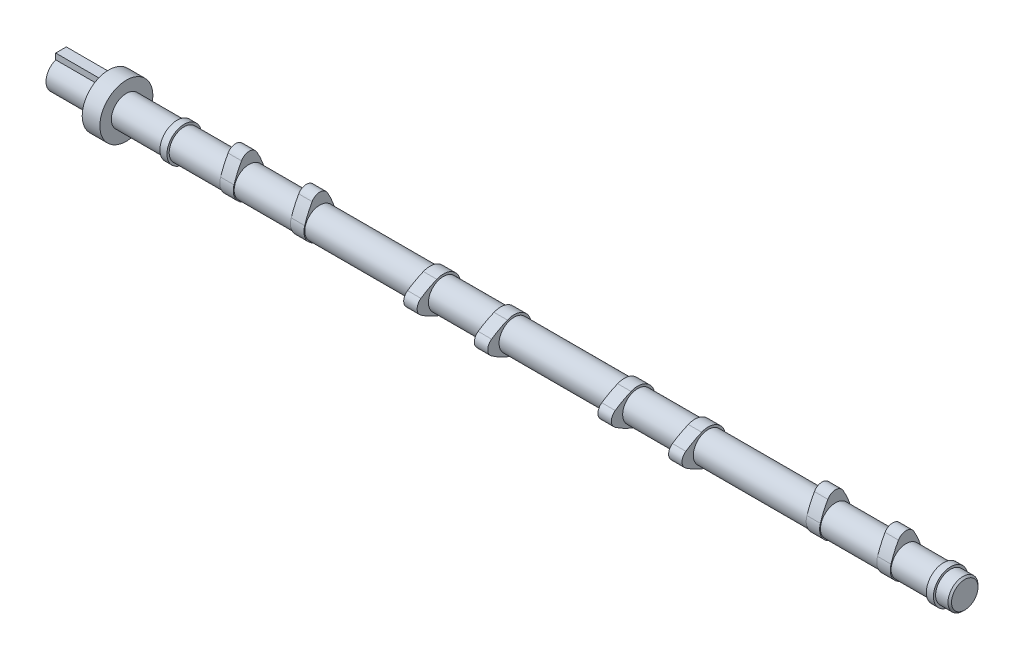
from build123d import *

# Parameters (mm, degrees)
CROQUIS1_W                       = 580
CROQUIS1_H                       = 8.5
CROQUIS4_R                       = 9.75
SALIENTE_EXTRUIR1_DEPTH          = 4
MATRIZL1_COUNT                   = 2
MATRIZL1_PITCH                   = 442
SALIENTE_EXTRUIR3_DEPTH          = 3.8
MATRIZL2_COUNT                   = 2
MATRIZL2_PITCH                   = 40
MATRIZL3_COUNT                   = 2
MATRIZL3_PITCH                   = 332
MATRIZL3_COPY_1_DEPTH            = 3.8
CROQUIS6_R                       = 8.5
SALIENTE_EXTRUIR4_DEPTH          = 3.8
MATRIZL4_COUNT                   = 2
MATRIZL4_PITCH                   = 40
MATRIZL5_COUNT                   = 2
MATRIZL5_PITCH                   = 110
MATRIZL5_COPY_1_SKETCH_R         = 8.5
MATRIZL5_COPY_1_DEPTH            = 3.8
CROQUIS7_R                       = 9.75
CORTAR_EXTRUIR1_DEPTH            = 12
SALIENTE_EXTRUIR5_START          = 4
CROQUIS8_R                       = 9.75
SALIENTE_EXTRUIR5_DEPTH          = 4
SALIENTE_EXTRUIR6_START          = 8
CROQUIS9_R                       = 8.5
SALIENTE_EXTRUIR6_DEPTH          = 8
CHAFL_N1_SIZE                    = 1
SALIENTE_EXTRUIR7_DEPTH          = 5
SALIENTE_EXTRUIR7_DEPTH_BACK     = 5
CROQUIS10_R                      = 15
CROQUIS11_W                      = 6
CROQUIS11_H                      = 3.35
SALIENTE_EXTRUIR8_DEPTH          = 40
CORTAR_EXTRUIR2_START            = -68.25
CROQUIS12_R                      = 47.247145798
CORTAR_EXTRUIR2_DEPTH            = 68.25
TALADRO_DE_MARGEN_PARA_M71_D     = 7.6
TALADRO_DE_MARGEN_PARA_M71_DEPTH = 30
TALADRO_DE_MARGEN_PARA_M71_TIP   = 2.283270352


with BuildPart() as part:
    # Croquis1 → Revolución1 (revolve)
    with BuildSketch(Plane.XY, mode=Mode.PRIVATE) as revoluci_n1_sk:
        with Locations((290, 4.25)):
            Rectangle(CROQUIS1_W, CROQUIS1_H)
    revolve(revoluci_n1_sk.sketch.rotate(Axis((0, 8.5, 0), (1, 0, 0)), 270), axis=Axis((0, 8.5, 0), (1, 0, 0)))

    # Croquis4 → Saliente-Extruir1 (add)
    with BuildSketch(Plane(origin=(580, 0, 0), x_dir=(0, 0, -1), z_dir=(1, 0, 0))):
        with Locations((0, 8.5)):
            Circle(CROQUIS4_R)
    saliente_extruir1 = extrude(amount=-SALIENTE_EXTRUIR1_DEPTH)

    # MatrizL1: Saliente-Extruir1 ×2
    with Locations(*[(-i * MATRIZL1_PITCH, 0, 0) for i in range(1, MATRIZL1_COUNT)]):
        add(saliente_extruir1)

    # Croquis5 → Saliente-Extruir3 (add, symmetric)
    with BuildSketch(Plane(origin=(171, 0, 0), x_dir=(0, 0, -1), z_dir=(1, 0, 0))):
        with BuildLine():
            ThreePointArc((-8.57686354, 11.227161863), (0, -0.5), (8.57686354, 11.227161863))
            ThreePointArc((8.57686354, 11.227161863), (6.71423124, 16.165722115), (4.341375372, 20.880415264))
            ThreePointArc((4.341375372, 20.880415264), (0, 23.4), (-4.341375372, 20.880415264))
            ThreePointArc((-4.341375372, 20.880415264), (-6.71423124, 16.165722115), (-8.57686354, 11.227161863))
        make_face()
    saliente_extruir3 = extrude(amount=SALIENTE_EXTRUIR3_DEPTH, both=True)

    # MatrizL2: Saliente-Extruir3 ×2
    with Locations(*[(i * MATRIZL2_PITCH, 0, 0) for i in range(1, MATRIZL2_COUNT)]):
        add(saliente_extruir3)

    # MatrizL3: Saliente-Extruir3 ×2
    with Locations(*[(i * MATRIZL3_PITCH, 0, 0) for i in range(1, MATRIZL3_COUNT)]):
        add(saliente_extruir3)

    # MatrizL3 copy 1 sketch → MatrizL3 copy 1 (add, symmetric)
    with BuildSketch(Plane(origin=(543, 0, 0), x_dir=(0, 0, -1), z_dir=(1, 0, 0))):
        with BuildLine():
            ThreePointArc((-8.57686354, 11.227161863), (0, -0.5), (8.57686354, 11.227161863))
            ThreePointArc((8.57686354, 11.227161863), (6.71423124, 16.165722115), (4.341375372, 20.880415264))
            ThreePointArc((4.341375372, 20.880415264), (0, 23.4), (-4.341375372, 20.880415264))
            ThreePointArc((-4.341375372, 20.880415264), (-6.71423124, 16.165722115), (-8.57686354, 11.227161863))
        make_face()
    extrude(amount=MATRIZL3_COPY_1_DEPTH, both=True)

    # Croquis6 → Saliente-Extruir4 (add, symmetric)
    with BuildSketch(Plane(origin=(281, 0, 0), x_dir=(0, 0, -1), z_dir=(1, 0, 0))):
        with BuildLine():
            ThreePointArc((-12.722376543, 12.627249768), (-14.9, 8.5), (-12.722376543, 4.372750232))
            ThreePointArc((-12.722376543, 4.372750232), (-8.363270987, 1.70804262), (-3.754994824, -0.497917196))
            ThreePointArc((-3.754994824, -0.497917196), (9.75, 8.5), (-3.754994824, 17.497917196))
            ThreePointArc((-3.754994824, 17.497917196), (-8.363270987, 15.29195738), (-12.722376543, 12.627249768))
        make_face()
        with Locations(Location((0, 8.5, 0), (0, 0, 180))):
            Circle(CROQUIS6_R, mode=Mode.SUBTRACT)
    saliente_extruir4 = extrude(amount=SALIENTE_EXTRUIR4_DEPTH, both=True)

    # MatrizL4: Saliente-Extruir4 ×2
    with Locations(*[(i * MATRIZL4_PITCH, 0, 0) for i in range(1, MATRIZL4_COUNT)]):
        add(saliente_extruir4)

    # MatrizL5: Saliente-Extruir4 ×2
    with Locations(*[(i * MATRIZL5_PITCH, 0, 0) for i in range(1, MATRIZL5_COUNT)]):
        add(saliente_extruir4)

    # MatrizL5 copy 1 sketch → MatrizL5 copy 1 (add, symmetric)
    with BuildSketch(Plane(origin=(431, 0, 0), x_dir=(0, 0, -1), z_dir=(1, 0, 0))):
        with BuildLine():
            ThreePointArc((-12.722376543, 12.627249768), (-14.9, 8.5), (-12.722376543, 4.372750232))
            ThreePointArc((-12.722376543, 4.372750232), (-8.363270987, 1.70804262), (-3.754994824, -0.497917196))
            ThreePointArc((-3.754994824, -0.497917196), (9.75, 8.5), (-3.754994824, 17.497917196))
            ThreePointArc((-3.754994824, 17.497917196), (-8.363270987, 15.29195738), (-12.722376543, 12.627249768))
        make_face()
        with Locations(Location((0, 8.5, 0), (0, 0, 180))):
            Circle(MATRIZL5_COPY_1_SKETCH_R, mode=Mode.SUBTRACT)
    extrude(amount=MATRIZL5_COPY_1_DEPTH, both=True)

    # Croquis7 → Cortar-Extruir1 (cut)
    with BuildSketch(Plane(origin=(580, 0, 0), x_dir=(0, 0, -1), z_dir=(1, 0, 0))):
        with Locations((0, 8.5)):
            Circle(CROQUIS7_R)
    extrude(amount=-CORTAR_EXTRUIR1_DEPTH, mode=Mode.SUBTRACT)

    # Croquis8 → Saliente-Extruir5 (add)
    with BuildSketch(Plane(origin=(568, 0, 0), x_dir=(0, 0, -1), z_dir=(1, 0, 0)).offset(SALIENTE_EXTRUIR5_START)):
        with Locations((0, 8.5)):
            Circle(CROQUIS8_R)
    extrude(amount=-SALIENTE_EXTRUIR5_DEPTH)

    # Croquis9 → Saliente-Extruir6 (add)
    with BuildSketch(Plane(origin=(572, 0, 0), x_dir=(0, 0, -1), z_dir=(1, 0, 0)).offset(SALIENTE_EXTRUIR6_START)):
        with Locations(Location((0, 8.5, 0), (0, 0, 180))):
            Circle(CROQUIS9_R)
    extrude(amount=-SALIENTE_EXTRUIR6_DEPTH)

    # Chaflán1
    chafl_n1_edges = [part.edges().sort_by_distance(p)[0] for p in [
        (580, 8.5, -8.5),
    ]]
    chamfer(chafl_n1_edges, length=CHAFL_N1_SIZE)

    # Croquis10 → Saliente-Extruir7 (add, two sides: drawn at the far end of the back side and taken through both)
    with BuildSketch(Plane.ZY.offset(-100.25).offset(-SALIENTE_EXTRUIR7_DEPTH_BACK)):
        with Locations((0, 8.5)):
            Circle(CROQUIS10_R)
    extrude(amount=SALIENTE_EXTRUIR7_DEPTH + SALIENTE_EXTRUIR7_DEPTH_BACK)

    # Croquis11 → Saliente-Extruir8 (add)
    with BuildSketch(Plane.ZY.offset(-95.25)):
        with Locations((0, 18.12798686)):
            Rectangle(CROQUIS11_W, CROQUIS11_H)
    extrude(amount=SALIENTE_EXTRUIR8_DEPTH)

    # Croquis12 → Cortar-Extruir2 (cut)
    with BuildSketch(Plane.ZY.offset(CORTAR_EXTRUIR2_START)):
        with Locations((1.341884727, 8.153797089)):
            Circle(CROQUIS12_R)
    extrude(amount=CORTAR_EXTRUIR2_DEPTH, mode=Mode.SUBTRACT)

    # Taladro de margen para M71
    with Locations(Plane(origin=(68.25, 8.5, 0), x_dir=(0, 0, -1), z_dir=(-1, 0, 0))):
        with Locations((0, 0)):
            Hole(TALADRO_DE_MARGEN_PARA_M71_D / 2, depth=TALADRO_DE_MARGEN_PARA_M71_DEPTH)
            with Locations((0, 0, -(TALADRO_DE_MARGEN_PARA_M71_DEPTH + TALADRO_DE_MARGEN_PARA_M71_TIP / 2))):  # 118° drill point
                Cone(0, TALADRO_DE_MARGEN_PARA_M71_D / 2, TALADRO_DE_MARGEN_PARA_M71_TIP, mode=Mode.SUBTRACT)


solid = part.part
